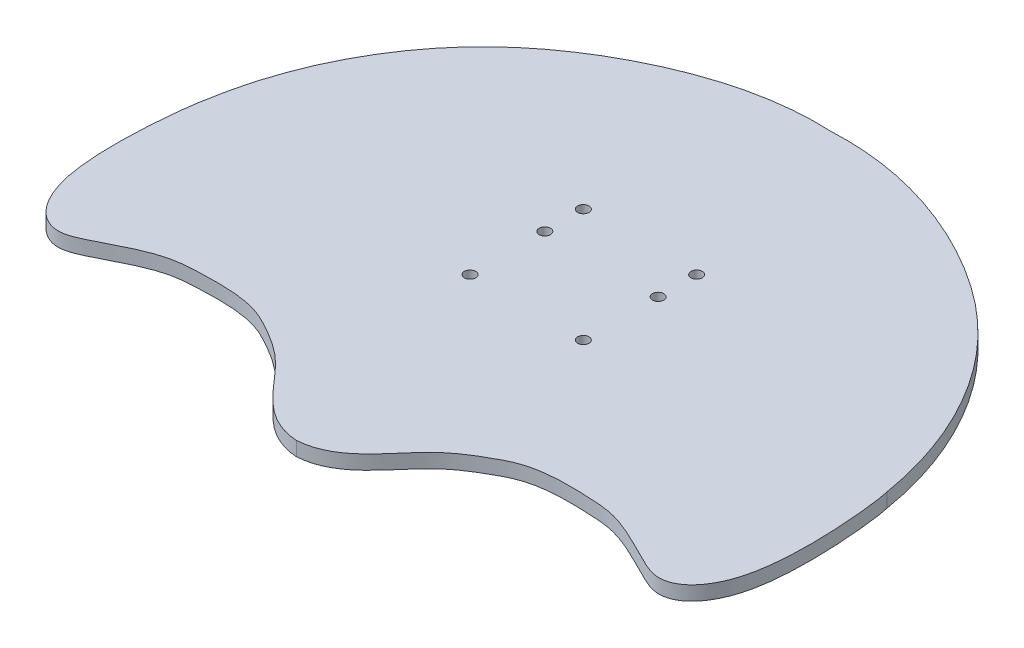
from build123d import *

# Parameters (mm, degrees)
BOSS_EXTRUDE1_DEPTH         = 7.9502
F_1_4_0_25_DIAMETER_HOLE1_D = 6.35


with BuildPart() as part:
    # Sketch3 → Boss-Extrude1 (new body)
    with BuildSketch(Plane(origin=(0, 0, 0), x_dir=(1, 0, 0), z_dir=(0, 1, 0))):
        with BuildLine():
            add(Edge.make_bspline(
                [(-190.5, 0), (-184.392726562, 37.537038237), (-157.261289847, 93.964093485), (-82.387478202, 146.622658841), (-31.311374143, 160.799884185), (0, 159.189909928)],
                knots=[0, 0, 0, 0, 0.424401366, 0.656369581, 1, 1, 1, 1], degree=3))
            add(Edge.make_bspline(
                [(190.5, 0), (184.392726562, 37.537038237), (157.261289847, 93.964093485), (82.387478202, 146.622658841), (31.311374143, 160.799884185), (0, 159.189909928)],
                knots=[0, 0, 0, 0, 0.424401366, 0.656369581, 1, 1, 1, 1], degree=3))
            add(Edge.make_bspline(
                [(190.5, 0), (192.064011793, -4.963501926), (201.967167766, -83.314618311), (174.696602041, -109.289958804), (151.630121659, -100.567984898), (131.410771519, -87.719783961), (96.843567628, -85.375403377), (78.692510144, -86.25882742), (58.833533072, -96.87938247), (37.30593461, -109.935798162), (21.349613946, -139.114767457), (0, -140.530090072)],
                knots=[0, 0, 0, 0, 0.166997052, 0.292320514, 0.319633117, 0.42673531, 0.45891405, 0.609241775, 0.641909704, 0.76680237, 1, 1, 1, 1], degree=3))
            add(Edge.make_bspline(
                [(-190.5, 0), (-192.064011793, -4.963501926), (-201.967167766, -83.314618311), (-174.696602041, -109.289958804), (-151.630121659, -100.567984898), (-131.410771519, -87.719783961), (-96.843567628, -85.375403377), (-78.692510144, -86.25882742), (-58.833533072, -96.87938247), (-37.30593461, -109.935798162), (-21.349613946, -139.114767457), (0, -140.530090072)],
                knots=[0, 0, 0, 0, 0.166997052, 0.292320514, 0.319633117, 0.42673531, 0.45891405, 0.609241775, 0.641909704, 0.76680237, 1, 1, 1, 1], degree=3))
        make_face()
    extrude(amount=BOSS_EXTRUDE1_DEPTH)

    # 1/4 (0.25) Diameter Hole1 (through all)
    with Locations(Plane(origin=(0, 0, 0), x_dir=(-1, 0, 0), z_dir=(0, -1, 0))):
        with Locations((-31.75, 52.07), (31.75, 52.07), (31.75, -11.43), (-31.75, -11.43), (-31.75, 30.48), (31.75, 30.48)):
            Hole(F_1_4_0_25_DIAMETER_HOLE1_D / 2)


solid = part.part
